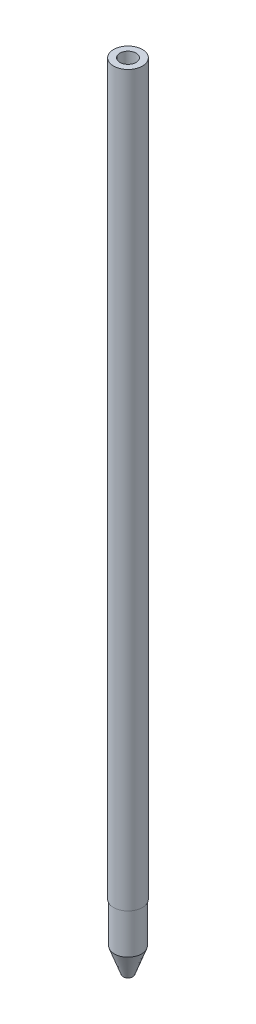
from build123d import *

# Parameters (mm, degrees)
SKETCH2_R           = 1.778
BOSS_EXTRUDE1_DEPTH = 89.9922
SKETCH3_R           = 1.6891
BOSS_EXTRUDE2_DEPTH = 8.001
SKETCH4_R           = 0.99949
CUT_EXTRUDE1_DEPTH  = 86.995
SKETCH5_R           = 1.7526
CUT_EXTRUDE2_DEPTH  = 2.9972


with BuildPart() as part:
    # Sketch2 → Boss-Extrude1 (new body)
    with BuildSketch(Plane(origin=(0, 0, 0), x_dir=(1, 0, 0), z_dir=(0, 1, 0))):
        with Locations(Location((0, 0, 0), (0, 0, 270))):
            Circle(SKETCH2_R)
    extrude(amount=BOSS_EXTRUDE1_DEPTH)

    # Sketch3 → Boss-Extrude2 (add)
    with BuildSketch(Plane(origin=(0, 2.9972, 0), x_dir=(1, 0, 0), z_dir=(0, 1, 0))):
        with Locations(Location((0, 0, 0), (0, 0, 270))):
            Circle(SKETCH3_R)
    extrude(amount=-BOSS_EXTRUDE2_DEPTH)

    # Sketch4 → Cut-Extrude1 (cut)
    with BuildSketch(Plane(origin=(0, 89.9922, 0), x_dir=(1, 0, 0), z_dir=(0, 1, 0))):
        with Locations(Location((0, 0, 0), (0, 0, 270))):
            Circle(SKETCH4_R)
    extrude(amount=-CUT_EXTRUDE1_DEPTH, mode=Mode.SUBTRACT)

    # Sketch5 → Cut-Extrude2 (cut)
    with BuildSketch(Plane(origin=(0, 2.9972, 0), x_dir=(1, 0, 0), z_dir=(0, 1, 0))):
        with Locations(Location((0, 0, 0), (0, 0, 270))):
            Circle(SKETCH5_R)
    extrude(amount=-CUT_EXTRUDE2_DEPTH, mode=Mode.SUBTRACT)


with BuildPart() as cut_extrude2_piece_1:
    # of the separate pieces the step leaves, piece 1, a body of its own (cut_extrude2_pieces)
    add(part.part.solids().sort_by_distance((0, 0, 1.778))[0])


with BuildPart() as cut_extrude2_piece_2:
    # of the separate pieces the step leaves, piece 2, a body of its own (cut_extrude2_pieces)
    add(part.part.solids().sort_by_distance((0, 0, 1.6891))[0])

    # Sketch6 → Revolve2 (revolve)
    with BuildSketch(Plane.XY, mode=Mode.PRIVATE) as revolve2_sk:
        Polygon((-1.6891, -5.0038), (-0.598208414, -8.001), (0, -8.001), (0, -5.0038), align=None)
    revolve(revolve2_sk.sketch.rotate(Axis((0, 0, 0), (0, -1, 0)), 270), axis=Axis((0, 0, 0), (0, -1, 0)))


solid = Compound([cut_extrude2_piece_1.part, cut_extrude2_piece_2.part])
